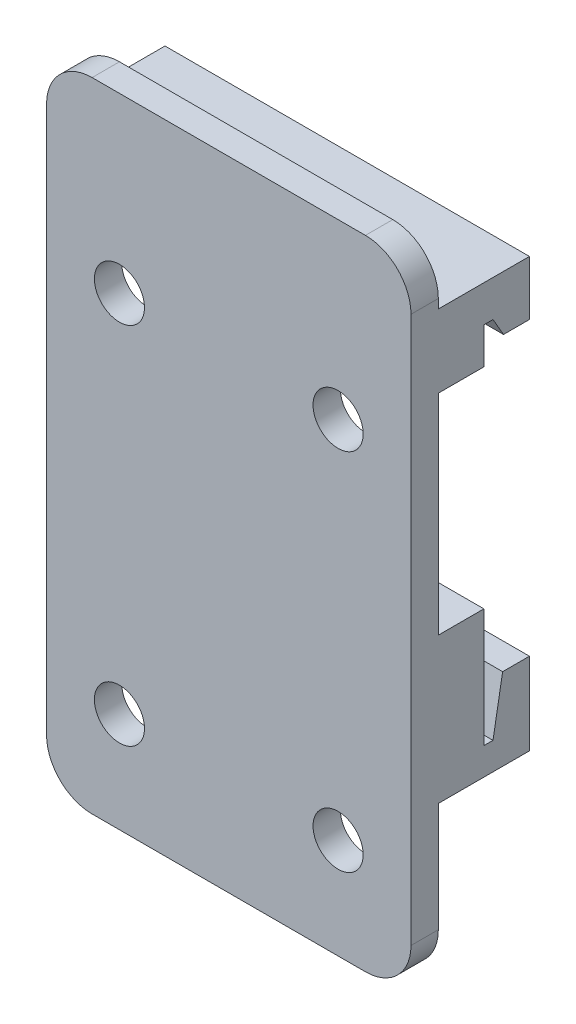
from build123d import *

# Parameters (mm, degrees)
SKETCH1_W           = 40
SKETCH1_H           = 70
BOSS_EXTRUDE1_DEPTH = 3
BOSS_EXTRUDE2_DEPTH = 20
BOSS_EXTRUDE3_DEPTH = 20
CUT_EXTRUDE1_DEPTH  = 13
BOSS_EXTRUDE4_DEPTH = 10
FILLET1_R           = 5
CUT_EXTRUDE2_REACH  = 43.533
SKETCH5_R           = 2.75
CUT_EXTRUDE4_DEPTH  = 2


with BuildPart() as part:
    # Sketch1 → Boss-Extrude1 (new body)
    with BuildSketch(Plane.XY):
        Rectangle(SKETCH1_W, SKETCH1_H)
    extrude(amount=BOSS_EXTRUDE1_DEPTH)

    # Sketch2 → Boss-Extrude2 (add, symmetric)
    with BuildSketch(Plane(origin=(0, 0, 0), x_dir=(0, 0, -1), z_dir=(1, 0, 0))):
        Polygon((0, 29), (10, 29), (10, 23), (7.154700538, 23), (6, 25), (5, 25), (5, 21), (0, 21), align=None)
    extrude(amount=BOSS_EXTRUDE2_DEPTH, both=True)

    # Sketch3 → Boss-Extrude3 (add, symmetric)
    with BuildSketch(Plane(origin=(0, 0, 0), x_dir=(0, 0, -1), z_dir=(1, 0, 0))):
        Polygon((0, -18), (10, -18), (10, -9), (7.057961884, -9), (6, -15), (5, -15), (5, -2), (0, -2), align=None)
    extrude(amount=BOSS_EXTRUDE3_DEPTH, both=True)

    # Sketch3<2> → Cut-Extrude1 (cut, symmetric)
    with BuildSketch(Plane(origin=(0, 0, 0), x_dir=(0, 0, -1), z_dir=(1, 0, 0))):
        Polygon((0, -18), (10, -18), (10, -9), (7.057961884, -9), (6, -15), (5, -15), (5, -2), (0, -2), align=None)
    extrude(amount=CUT_EXTRUDE1_DEPTH, both=True, mode=Mode.SUBTRACT)

    # Sketch4 → Boss-Extrude4 (add)
    with BuildSketch(Plane.XY):
        with BuildLine():
            Line((13, -18), (-13, -18))
            Line((-13, -18), (-13, -15))
            Line((-13, -15), (11.2, -15))
            add(Edge.make_bspline(
                [(11.2, -15), (7.988659261, -12.305365171), (4.131076897, -9.981226783), (-4.059161179, -9.974707843), (-6.438372816, -13.757567443), (-9.210423341, -14.299843052), (-11, -12.5)],
                knots=[0, 0, 0, 0, 0.361861055, 0.44515142, 0.789820069, 1, 1, 1, 1], degree=3))
            Line((-11, -12.5), (-11, -11.5))
            add(Edge.make_bspline(
                [(13, -15), (9.091847393, -11.720670589), (5.160163517, -9.012654879), (-4.52853577, -8.942546967), (-6.581487755, -13.325064148), (-9.8688482, -13.174994697), (-11, -11.5)],
                knots=[0, 0, 0, 0, 0.360137541, 0.439165428, 0.751266273, 1, 1, 1, 1], degree=3))
            Line((13, -15), (13, -18))
        make_face()
    extrude(amount=-BOSS_EXTRUDE4_DEPTH)

    # Fillet1
    fillet1_edges = [part.edges().sort_by_distance(p)[0] for p in [
        (20, -35, 1.5),
        (-20, -35, 1.5),
        (-20, 35, 1.5),
        (20, 35, 1.5),
    ]]
    fillet(fillet1_edges, radius=FILLET1_R)

    # Sketch5 → Cut-Extrude2 (cut, up to next)
    with BuildSketch(Plane.XY, mode=Mode.PRIVATE) as cut_extrude2_sk1:
        with Locations((-12, 16)):
            Circle(SKETCH5_R)
    cut_extrude2_tool1 = extrude(cut_extrude2_sk1.sketch, amount=CUT_EXTRUDE2_REACH, mode=Mode.PRIVATE) & part.part
    # Sketch5 → Cut-Extrude2 (cut, up to next)
    with BuildSketch(Plane.XY, mode=Mode.PRIVATE) as cut_extrude2_sk2:
        with Locations((12, 16)):
            Circle(SKETCH5_R)
    cut_extrude2_tool2 = extrude(cut_extrude2_sk2.sketch, amount=CUT_EXTRUDE2_REACH, mode=Mode.PRIVATE) & part.part
    # Sketch5 → Cut-Extrude2 (cut, up to next)
    with BuildSketch(Plane.XY, mode=Mode.PRIVATE) as cut_extrude2_sk3:
        with Locations((-12, -24)):
            Circle(SKETCH5_R)
    cut_extrude2_tool3 = extrude(cut_extrude2_sk3.sketch, amount=CUT_EXTRUDE2_REACH, mode=Mode.PRIVATE) & part.part
    # Sketch5 → Cut-Extrude2 (cut, up to next)
    with BuildSketch(Plane.XY, mode=Mode.PRIVATE) as cut_extrude2_sk4:
        with Locations((12, -24)):
            Circle(SKETCH5_R)
    cut_extrude2_tool4 = extrude(cut_extrude2_sk4.sketch, amount=CUT_EXTRUDE2_REACH, mode=Mode.PRIVATE) & part.part
    add(cut_extrude2_tool1.solids().sort_by_distance((-12, 16, 0))[0], mode=Mode.SUBTRACT)
    add(cut_extrude2_tool2.solids().sort_by_distance((12, 16, 0))[0], mode=Mode.SUBTRACT)
    add(cut_extrude2_tool3.solids().sort_by_distance((-12, -24, 0))[0], mode=Mode.SUBTRACT)
    add(cut_extrude2_tool4.solids().sort_by_distance((12, -24, 0))[0], mode=Mode.SUBTRACT)

    # Sketch4<2> → Cut-Extrude4 (cut)
    with BuildSketch(Plane.XY):
        with BuildLine():
            Line((13, -18), (-13, -18))
            Line((-13, -18), (-13, -15))
            Line((-13, -15), (11.2, -15))
            add(Edge.make_bspline(
                [(11.2, -15), (7.988659261, -12.305365171), (4.131076897, -9.981226783), (-4.059161179, -9.974707843), (-6.438372816, -13.757567443), (-9.210423341, -14.299843052), (-11, -12.5)],
                knots=[0, 0, 0, 0, 0.361861055, 0.44515142, 0.789820069, 1, 1, 1, 1], degree=3))
            Line((-11, -12.5), (-11, -11.5))
            add(Edge.make_bspline(
                [(13, -15), (9.091847393, -11.720670589), (5.160163517, -9.012654879), (-4.52853577, -8.942546967), (-6.581487755, -13.325064148), (-9.8688482, -13.174994697), (-11, -11.5)],
                knots=[0, 0, 0, 0, 0.360137541, 0.439165428, 0.751266273, 1, 1, 1, 1], degree=3))
            Line((13, -15), (13, -18))
        make_face()
    extrude(amount=-CUT_EXTRUDE4_DEPTH, mode=Mode.SUBTRACT)


solid = part.part
